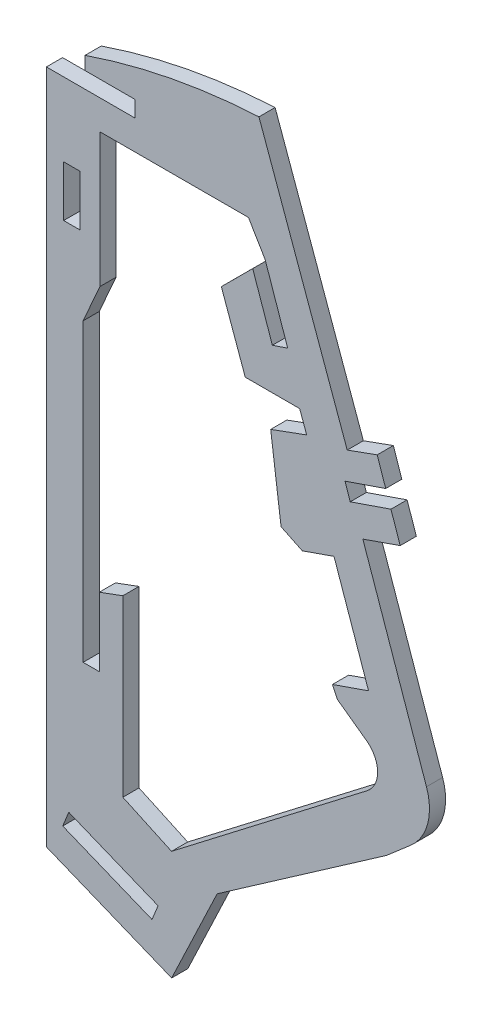
from build123d import *

# Parameters (mm, degrees)
SKETCH1_W           = 3
SKETCH1_H           = 9.45
BASE_EXTRUDE_DEPTH  = 3
SKETCH2_W           = 10
SKETCH2_H           = 3
BOSS_EXTRUDE1_DEPTH = 3


with BuildPart() as part:
    # Sketch1 → Base-Extrude (new body)
    with BuildSketch(Plane.XY):
        with BuildLine():
            Line((1079.876919763, -44.105153511), (1068.056216666, -10.172974917))
            Line((1068.056216666, -10.172974917), (1074.996757052, -7.75514999))
            Line((1074.996757052, -7.75514999), (1073.279825248, -2.753207543))
            Line((1073.279825248, -2.753207543), (1065.713177122, -5.350482293))
            Line((1065.713177122, -5.350482293), (1064.73919909, -2.512989245))
            Line((1064.73919909, -2.512989245), (1072.305847217, 0.084285505))
            Line((1072.305847217, 0.084285505), (1070.719575987, 4.705574119))
            Line((1070.719575987, 4.705574119), (1065.157526034, 2.696840543))
            Line((1065.157526034, 2.696840543), (1048.759611565, 48.101577381))
            ThreePointArc((1048.759611565, 48.101577381), (1032.39485012, 46.101647559), (1016.466345621, 41.848662618))
            Line((1016.466345621, 41.848662618), (1016.466345621, 39.392602571))
            Line((1016.466345621, 39.392602571), (1035.726137056, 39.392602571))
            Line((1035.726137056, 39.392602571), (1035.726137056, 36.392602571))
            Line((1035.726137056, 36.392602571), (1009.279499751, 36.392602571))
            Line((1009.279499751, 36.392602571), (1009.279499751, -89.073987735))
            Line((1009.279499751, -89.073987735), (1032.543515661, -98.536722682))
            Line((1032.543515661, -98.536722682), (1040.991113984, -80.770341528))
            Line((1040.991113984, -80.770341528), (1072.440441541, -58.876157059))
            Line((1072.440441541, -58.876157059), (1076.9710582, -54.961956755))
            ThreePointArc((1076.9710582, -54.961956755), (1080.093496996, -49.980404823), (1079.876919763, -44.105153511))
        make_face()
        with BuildLine():
            Line((1019.213878108, 30.925856164), (1019.213878108, 6.018771541))
            Line((1019.213878108, 6.018771541), (1016.100082492, -1.038872257))
            Line((1016.100082492, -1.038872257), (1016.100082492, -55.976738358))
            Line((1016.100082492, -55.976738358), (1019.100082492, -55.976738358))
            Line((1019.100082492, -55.976738358), (1019.100082492, -43.198135443))
            Line((1019.100082492, -43.198135443), (1023.478597046, -41.580404808))
            Line((1023.478597046, -41.580404808), (1023.478597046, -73.992128786))
            Line((1023.478597046, -73.992128786), (1032.526582577, -78.167039678))
            Line((1032.526582577, -78.167039678), (1068.850484509, -50.258348586))
            ThreePointArc((1068.850484509, -50.258348586), (1070.803657728, -46.221334872), (1068.734776871, -42.242378056))
            Line((1068.734776871, -42.242378056), (1063.325122863, -38.329012558))
            Line((1063.325122863, -38.329012558), (1062.407393196, -36.386031272))
            Line((1062.407393196, -36.386031272), (1069.115709638, -34.04910449))
            Line((1069.115709638, -34.04910449), (1062.700744223, -15.634484789))
            Line((1062.700744223, -15.634484789), (1056.810312455, -17.686491112))
            Line((1056.810312455, -17.686491112), (1052.869598475, -15.779326268))
            Line((1052.869598475, -15.779326268), (1050.941521122, -1.083078235))
            Line((1050.941521122, -1.083078235), (1057.625060998, 1.362146575))
            Line((1057.625060998, 1.362146575), (1056.321001716, 4.948397029))
            Line((1056.321001716, 4.948397029), (1046.214175082, 4.948397029))
            Line((1046.214175082, 4.948397029), (1041.773169547, 17.294470752))
            Line((1041.773169547, 17.294470752), (1047.600835278, 23.111994965))
            Line((1047.600835278, 23.111994965), (1051.253809923, 12.605592538))
            Line((1051.253809923, 12.605592538), (1054.100349004, 13.552807012))
            Line((1054.100349004, 13.552807012), (1049.909104568, 25.720739733))
            Line((1049.909104568, 25.720739733), (1046.816291402, 30.939914406))
            Line((1046.816291402, 30.939914406), (1019.213878108, 30.925856164))
        make_face(mode=Mode.SUBTRACT)
        Polygon((1012.307844389, -84.207250741), (1013.438177941, -81.428339792), (1030.025357256, -88.175243766), (1028.895023704, -90.954154714), align=None, mode=Mode.SUBTRACT)
        with Locations((1013.982987836, 18.006853638)):
            Rectangle(SKETCH1_W, SKETCH1_H, mode=Mode.SUBTRACT)
    extrude(amount=BASE_EXTRUDE_DEPTH)

    # Sketch2 → Boss-Extrude1 (add)
    with BuildSketch(Plane.XY.offset(3)):
        with Locations((1030.726137056, 37.892602571)):
            Rectangle(SKETCH2_W, SKETCH2_H)
    extrude(amount=-BOSS_EXTRUDE1_DEPTH)


solid = part.part
